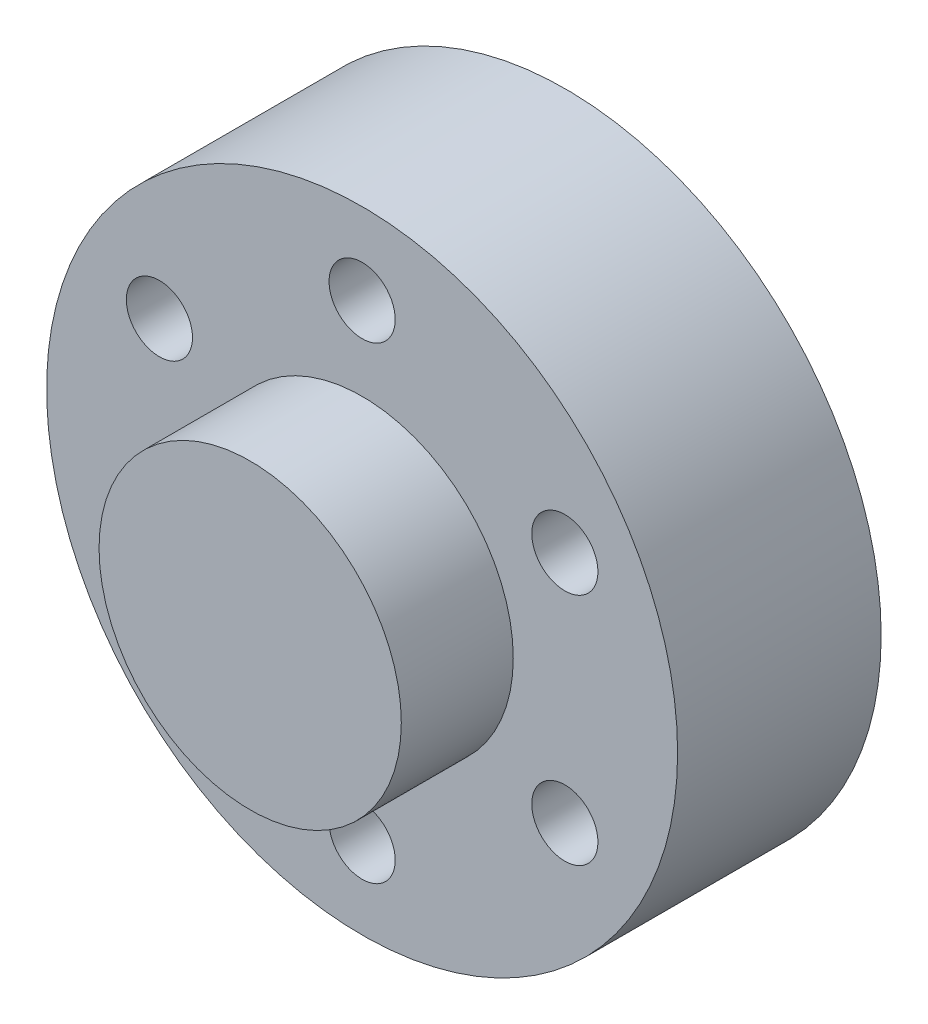
from build123d import *

# Parameters (mm, degrees)
SKETCH2_R           = 15.5
SKETCH2_R_2         = 1.625
BOSS_EXTRUDE1_DEPTH = 10
SKETCH3_R           = 7.425
BOSS_EXTRUDE2_DEPTH = 5.5
BOSS_EXTRUDE4_START = 5.5
SKETCH6_R           = 7.425
BOSS_EXTRUDE4_DEPTH = 5.5
SKETCH7_R           = 2
BOSS_EXTRUDE5_DEPTH = 1
FILLET2_R           = 0.05
CUT_EXTRUDE1_DEPTH  = 11


with BuildPart() as part:
    # Sketch2 → Boss-Extrude1 (new body)
    with BuildSketch(Plane.XY):
        Circle(SKETCH2_R)
        with Locations((0, 11.5)):
            Circle(SKETCH2_R_2, mode=Mode.SUBTRACT)
        with Locations((9.959292144, 5.75)):
            Circle(SKETCH2_R_2, mode=Mode.SUBTRACT)
        with Locations((9.959292144, -5.75)):
            Circle(SKETCH2_R_2, mode=Mode.SUBTRACT)
        with Locations((0, -11.5)):
            Circle(SKETCH2_R_2, mode=Mode.SUBTRACT)
        with Locations((-9.959292144, -5.75)):
            Circle(SKETCH2_R_2, mode=Mode.SUBTRACT)
        with Locations((-9.959292144, 5.75)):
            Circle(SKETCH2_R_2, mode=Mode.SUBTRACT)
    extrude(amount=BOSS_EXTRUDE1_DEPTH)

    # Sketch3 → Boss-Extrude2 (add)
    with BuildSketch(Plane.XY.offset(10)):
        Circle(SKETCH3_R)
    extrude(amount=BOSS_EXTRUDE2_DEPTH)

    # Sketch6 → Boss-Extrude4 (add)
    with BuildSketch(Plane(origin=(0, 0, 0), x_dir=(-1, 0, 0), z_dir=(0, 0, -1)).offset(BOSS_EXTRUDE4_START)):
        with Locations(Location((0, 0, 0), (0, 0, 180))):
            Circle(SKETCH6_R)
    extrude(amount=-BOSS_EXTRUDE4_DEPTH)

    # Sketch7 → Boss-Extrude5 (add)
    with BuildSketch(Plane(origin=(0, 0, -5.5), x_dir=(-1, 0, 0), z_dir=(0, 0, -1))):
        Circle(SKETCH7_R)
    extrude(amount=BOSS_EXTRUDE5_DEPTH)

    # Fillet2
    fillet2_edges = [part.edges().sort_by_distance(p)[0] for p in [
        (2, 0, -6.5),
    ]]
    fillet(fillet2_edges, radius=FILLET2_R)

    # Sketch9 → Cut-Extrude1 (cut)
    with BuildSketch(Plane(origin=(0, 0, -6.5), x_dir=(-1, 0, 0), z_dir=(0, 0, -1))):
        with BuildLine():
            Line((-1.224744871, 1.25), (1.224744871, 1.25))
            ThreePointArc((1.224744871, 1.25), (0, -1.75), (-1.224744871, 1.25))
        make_face()
    extrude(amount=-CUT_EXTRUDE1_DEPTH, mode=Mode.SUBTRACT)


solid = part.part
